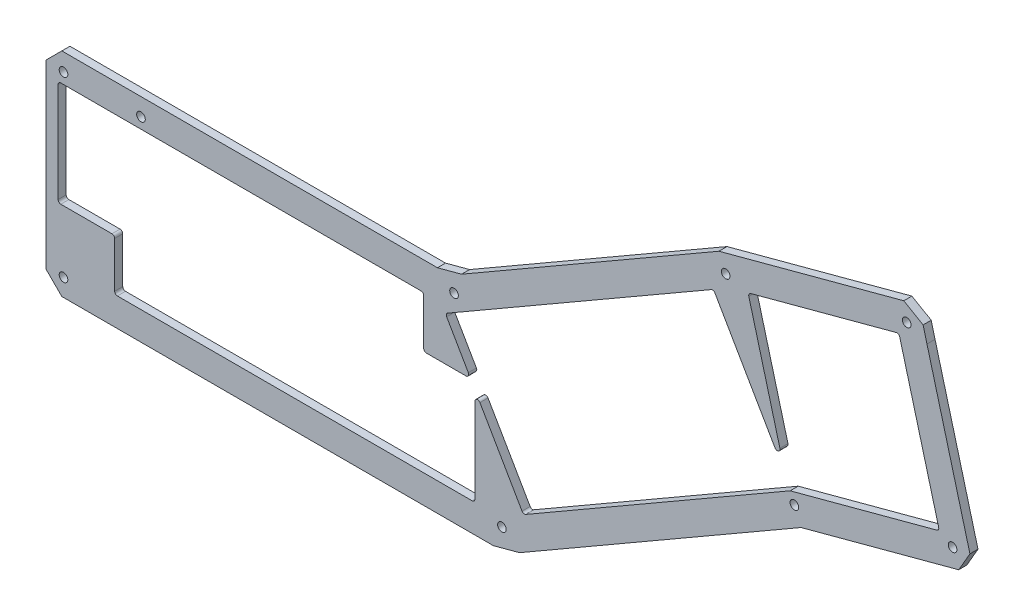
from build123d import *

# Parameters (mm, degrees)
ESQUISSE1_R        = 1.6
BOSS_EXTRU_1_DEPTH = 3


with BuildPart() as part:
    # Esquisse1 → Boss.-Extru.1 (new body)
    with BuildSketch(Plane.XY):
        Polygon((-75.988646329, 50.585106383), (-96.375082906, 50.585106383), (-102.253762562, 44.706426727), (-102.253762562, 35.79522772), (-102.253762562, -22.536213961), (-96.375082906, -28.414893617), (63.866204609, -28.414893617), (73.57783127, -25.812671096), (178.129773206, 34.550420725), (236.676113061, 50.237865209), (240.83296731, 57.437747969), (229.542938833, 99.572707865), (224.885316316, 116.95519174), (223.46218398, 122.391704558), (216.287606244, 126.561599525), (210.79963, 125.091100722), (147.636911389, 108.166701279), (52.055735868, 52.982883862), (43.107108491, 50.585106383), align=None)
        with Locations((-95.753762562, 44.085106383)):
            Circle(ESQUISSE1_R, mode=Mode.SUBTRACT)
        with Locations((-66.988646329, 44.085106383)):
            Circle(ESQUISSE1_R, mode=Mode.SUBTRACT)
        with Locations((-95.753762562, -21.914893617)):
            Circle(ESQUISSE1_R, mode=Mode.SUBTRACT)
        with Locations((49.263745973, 45.505477252)):
            Circle(ESQUISSE1_R, mode=Mode.SUBTRACT)
        with Locations((67.039694146, -20.835264486)):
            Circle(ESQUISSE1_R, mode=Mode.SUBTRACT)
        with Locations((175.637377655, 40.567595866)):
            Circle(ESQUISSE1_R, mode=Mode.SUBTRACT)
        with Locations((234.393639901, 56.355573542)):
            Circle(ESQUISSE1_R, mode=Mode.SUBTRACT)
        with Locations((217.363403759, 120.120565138)):
            Circle(ESQUISSE1_R, mode=Mode.SUBTRACT)
        with Locations((150.12930694, 102.149526137)):
            Circle(ESQUISSE1_R, mode=Mode.SUBTRACT)
        with BuildLine():
            Line((-97.753762562, 39.085106383), (-97.753762562, 2.085106383))
            ThreePointArc((-97.753762562, 2.085106383), (-97.460869343, 1.377999602), (-96.753762562, 1.085106383))
            Line((-96.753762562, 1.085106383), (-77.753762562, 1.085106383))
            ThreePointArc((-77.753762562, 1.085106383), (-77.046655781, 0.792213164), (-76.753762562, 0.085106383))
            Line((-76.753762562, 0.085106383), (-76.753762562, -16.914893617))
            ThreePointArc((-76.753762562, -16.914893617), (-76.460869343, -17.622000398), (-75.753762562, -17.914893617))
            Line((-75.753762562, -17.914893617), (56.011353671, -17.914893617))
            ThreePointArc((56.011353671, -17.914893617), (56.718460453, -17.622000398), (57.011353671, -16.914893617))
            Line((57.011353671, -16.914893617), (57.011353671, 14.621004768))
            ThreePointArc((57.011353671, 14.621004768), (57.752534626, 15.586930594), (58.877379075, 15.121004768))
            Line((58.877379075, 15.121004768), (74.527293708, -11.98544251))
            ThreePointArc((74.527293708, -11.98544251), (75.134500067, -12.451368337), (75.893319112, -12.351467914))
            Line((75.893319112, -12.351467914), (174.076924484, 44.334863077))
            Line((174.076924484, 44.334863077), (228.528734589, 58.925181621))
            ThreePointArc((228.528734589, 58.925181621), (229.135940948, 59.391107448), (229.235841371, 60.149926493))
            Line((229.235841371, 60.149926493), (214.741974845, 114.241772765))
            ThreePointArc((214.741974845, 114.241772765), (214.276049019, 114.848979124), (213.517229973, 114.948879546))
            Line((213.517229973, 114.948879546), (159.425383701, 100.45501302))
            ThreePointArc((159.425383701, 100.45501302), (158.818177343, 99.989087194), (158.71827692, 99.230268149))
            Line((158.71827692, 99.230268149), (170.271736655, 56.112169417))
            ThreePointArc((170.271736655, 56.112169417), (169.688494261, 54.929470839), (168.439785425, 55.353350371))
            Line((168.439785425, 55.353350371), (146.120215143, 94.011980101))
            ThreePointArc((146.120215143, 94.011980101), (145.513008785, 94.477905928), (144.75418974, 94.378005505))
            Line((144.75418974, 94.378005505), (46.893319112, 37.878005505))
            ThreePointArc((46.893319112, 37.878005505), (46.427393286, 37.270799147), (46.527293708, 36.511980101))
            Line((46.527293708, 36.511980101), (54.567977999, 22.585106383))
            ThreePointArc((54.567977999, 22.585106383), (54.567977999, 21.585106383), (53.701952595, 21.085106383))
            Line((53.701952595, 21.085106383), (39.011353671, 21.085106383))
            ThreePointArc((39.011353671, 21.085106383), (38.30424689, 21.377999602), (38.011353671, 22.085106383))
            Line((38.011353671, 22.085106383), (38.011353671, 39.085106383))
            ThreePointArc((38.011353671, 39.085106383), (37.718460453, 39.792213164), (37.011353671, 40.085106383))
            Line((37.011353671, 40.085106383), (-96.753762562, 40.085106383))
            ThreePointArc((-96.753762562, 40.085106383), (-97.460869343, 39.792213164), (-97.753762562, 39.085106383))
        make_face(mode=Mode.SUBTRACT)
    extrude(amount=BOSS_EXTRU_1_DEPTH)


solid = part.part
